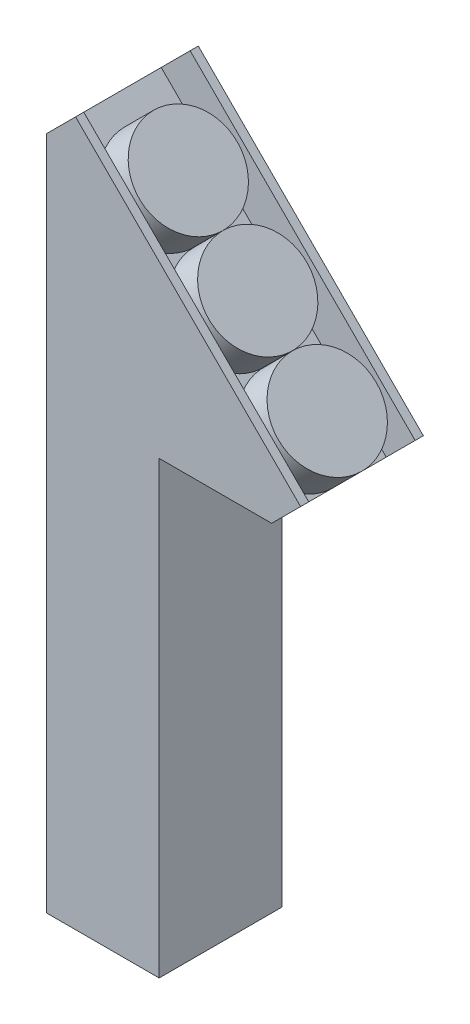
from build123d import *

# Parameters (mm, degrees)
BOSS_EXTRUDE2_DEPTH = 30
SKETCH2_W           = 2
SKETCH2_H           = 77.78174593
BOSS_EXTRUDE3_DEPTH = 10
SKETCH3_W           = 27.5
SKETCH3_H           = 30
BOSS_EXTRUDE4_DEPTH = 110
SKETCH4_R           = 12.012972295
SKETCH4_R_2         = 12
BOSS_EXTRUDE8_DEPTH = 10


with BuildPart() as part:
    # Sketch1 → Boss-Extrude2 (new body)
    with BuildSketch(Plane.XY):
        Polygon((0, 0), (0, 55), (55, 0), align=None)
    extrude(amount=-BOSS_EXTRUDE2_DEPTH)

    # Sketch2 → Boss-Extrude3 (add)
    with BuildSketch(Plane(origin=(27.5, 27.5, 0), x_dir=(0, 0, -1), z_dir=(0.7071067811865477, 0.7071067811865475, 0))):
        with Locations((1, 0)):
            Rectangle(SKETCH2_W, SKETCH2_H)
        with Locations((29, 0)):
            Rectangle(SKETCH2_W, SKETCH2_H)
    extrude(amount=BOSS_EXTRUDE3_DEPTH)

    # Sketch3 → Boss-Extrude4 (add)
    with BuildSketch(Plane.XZ):
        with Locations((13.75, -15)):
            Rectangle(SKETCH3_W, SKETCH3_H)
    extrude(amount=BOSS_EXTRUDE4_DEPTH)

    # Sketch4 → Boss-Extrude8 (add)
    with BuildSketch(Plane(origin=(27.5, 27.5, 0), x_dir=(0, 0, -1), z_dir=(0.7071067811865477, 0.7071067811865475, 0))):
        with Locations(Location((15, -26.87790067, 0), (0, 0, 270))):
            Circle(SKETCH4_R)
        with Locations(Location((15, -2.860782845, 0), (0, 0, 90))):
            Circle(SKETCH4_R_2)
        with Locations(Location((15, 21.143362684, 0), (0, 0, 90))):
            Circle(SKETCH4_R_2)
    extrude(amount=BOSS_EXTRUDE8_DEPTH)


solid = part.part
